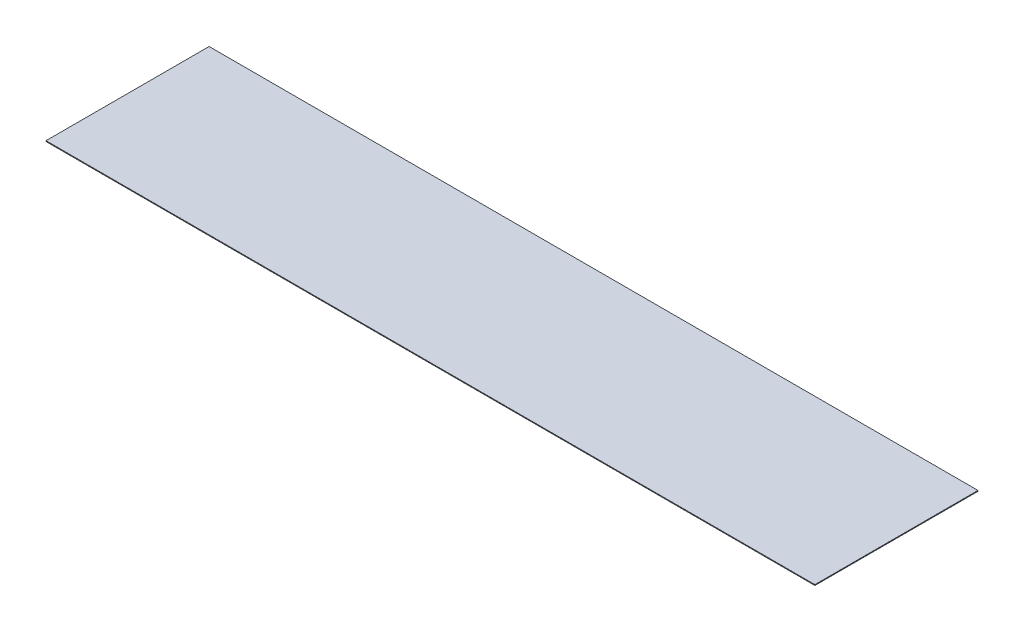
from build123d import *

# Parameters (mm, degrees)
CROQUIS1_W              = 99
CROQUIS1_H              = 21
SALIENTE_EXTRUIR1_DEPTH = 0.1


with BuildPart() as part:
    # Croquis1 → Saliente-Extruir1 (new body)
    with BuildSketch(Plane(origin=(0, 0, 0), x_dir=(1, 0, 0), z_dir=(0, 1, 0))):
        Rectangle(CROQUIS1_W, CROQUIS1_H)
    extrude(amount=SALIENTE_EXTRUIR1_DEPTH)


solid = part.part
